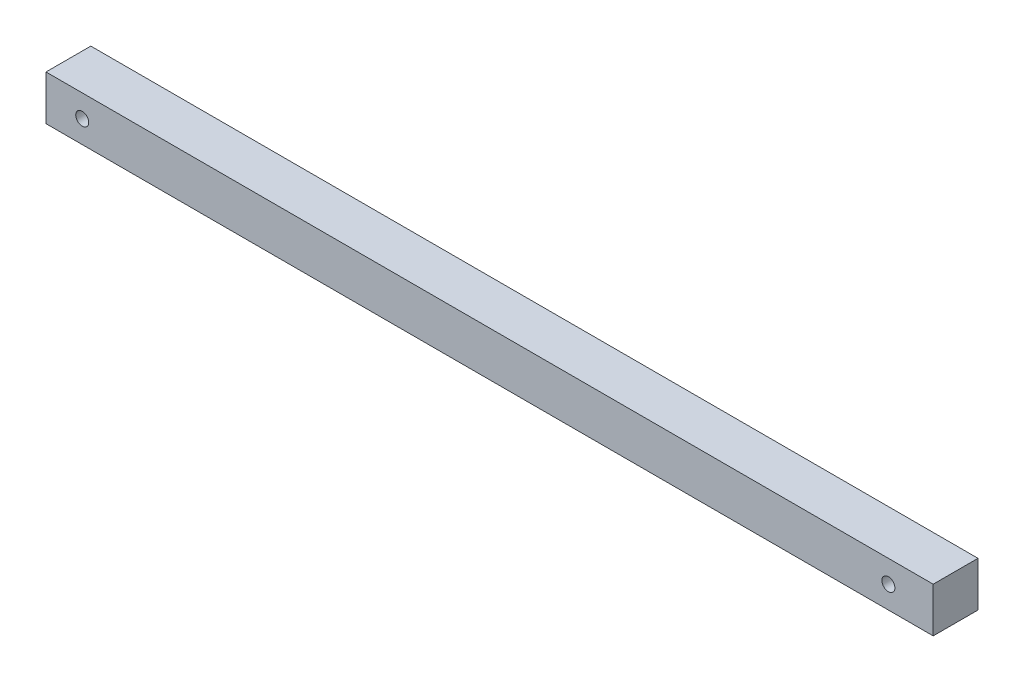
from build123d import *

# Parameters (mm, degrees)
SKETCH1_W              = 198
SKETCH1_H              = 10
BOSS_EXTRUDE1_DEPTH    = 5
M2_5_CLEARANCE_HOLE1_D = 2.9


with BuildPart() as part:
    # Sketch1 → Boss-Extrude1 (new, symmetric)
    with BuildSketch(Plane.XY):
        Rectangle(SKETCH1_W, SKETCH1_H)
    extrude(amount=BOSS_EXTRUDE1_DEPTH, both=True)

    # M2.5 Clearance Hole1 (through all)
    with Locations(Plane(origin=(0, 0, -5), x_dir=(-1, 0, 0), z_dir=(0, 0, -1))):
        with Locations((-89, 0), (90.9182, 0)):
            Hole(M2_5_CLEARANCE_HOLE1_D / 2)


solid = part.part
